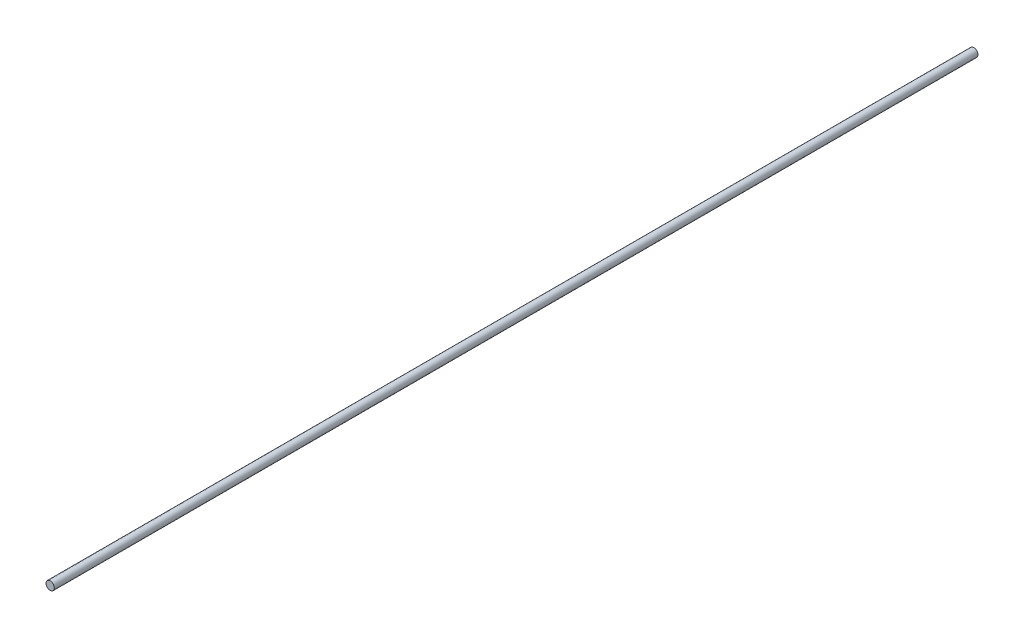
from build123d import *

# Parameters (mm, degrees)
SKETCH1_R           = 9
BOSS_EXTRUDE1_DEPTH = 1000


with BuildPart() as part:
    # Sketch1 → Boss-Extrude1 (new, symmetric)
    with BuildSketch(Plane.XY):
        Circle(SKETCH1_R)
    extrude(amount=BOSS_EXTRUDE1_DEPTH, both=True)


solid = part.part
